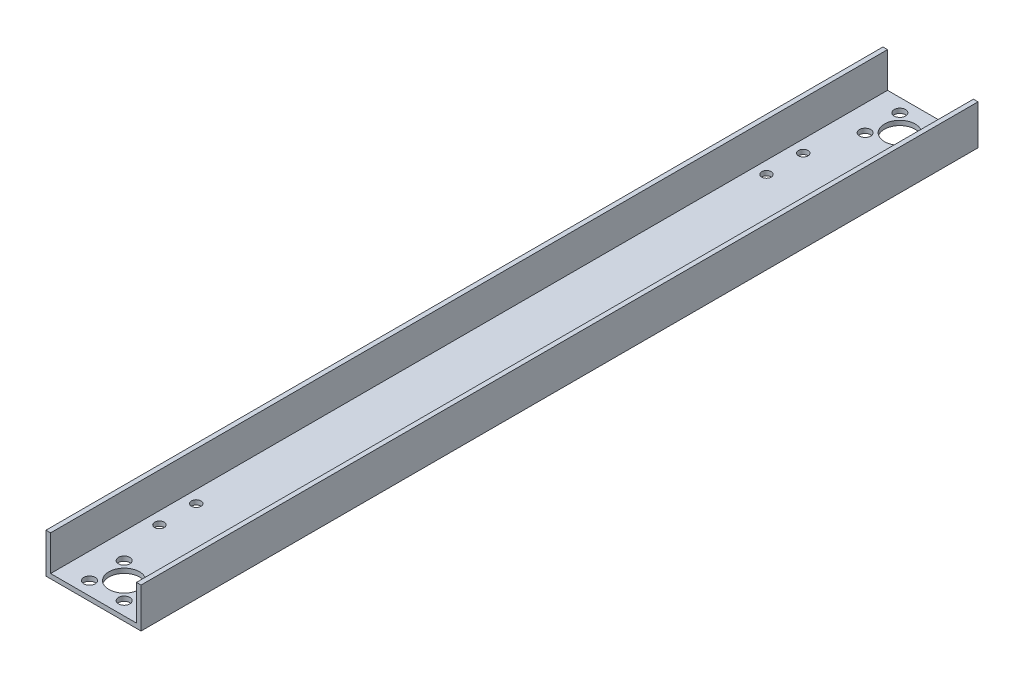
from build123d import *

# Parameters (mm, degrees)
BOSS_EXTRUDE1_DEPTH = 273
SKETCH3_R           = 1.85
SKETCH3_R_2         = 5
CUT_EXTRUDE1_DEPTH  = 273
SKETCH5_R           = 1.55
CUT_EXTRUDE2_DEPTH  = 220


with BuildPart() as part:
    # Sketch1 → Boss-Extrude1 (new body)
    with BuildSketch(Plane.XY):
        Polygon((14, 6.5), (15.5, 6.5), (15.5, -6.5), (-15.5, -6.5), (-15.5, 6.5), (-14, 6.5), (-14, -5), (14, -5), align=None)
    extrude(amount=BOSS_EXTRUDE1_DEPTH)

    # Sketch3 → Cut-Extrude1 (cut)
    with BuildSketch(Plane(origin=(0, -5, 0), x_dir=(1, 0, 0), z_dir=(0, 1, 0))):
        with Locations(Location((-5.656854249, -4.343145751, 0), (0, 0, 270))):
            Circle(SKETCH3_R)
        with Locations(Location((0, -263, 0), (0, 0, 270))):
            Circle(SKETCH3_R_2)
        with Locations(Location((-5.656854249, -257.343145751, 0), (0, 0, 270))):
            Circle(SKETCH3_R)
        with Locations(Location((5.656854249, -257.343145751, 0), (0, 0, 270))):
            Circle(SKETCH3_R)
        with Locations(Location((5.656854249, -268.656854249, 0), (0, 0, 270))):
            Circle(SKETCH3_R)
        with Locations(Location((-5.656854249, -268.656854249, 0), (0, 0, 270))):
            Circle(SKETCH3_R)
        with Locations(Location((5.656854249, -4.343145751, 0), (0, 0, 270))):
            Circle(SKETCH3_R)
        with Locations(Location((5.656854249, -15.656854249, 0), (0, 0, 270))):
            Circle(SKETCH3_R)
        with Locations(Location((-5.656854249, -15.656854249, 0), (0, 0, 270))):
            Circle(SKETCH3_R)
        with Locations(Location((0, -10, 0), (0, 0, 270))):
            Circle(SKETCH3_R_2)
    extrude(amount=-CUT_EXTRUDE1_DEPTH, mode=Mode.SUBTRACT)

    # Sketch5 → Cut-Extrude2 (cut)
    with BuildSketch(Plane.XZ.offset(6.5)):
        with Locations(Location((-10, 229.5, 0), (0, 0, 270))):
            Circle(SKETCH5_R)
        with Locations(Location((-10, 241.5, 0), (0, 0, 270))):
            Circle(SKETCH5_R)
        with Locations(Location((10, 229.5, 0), (0, 0, 270))):
            Circle(SKETCH5_R)
        with Locations(Location((10, 241.5, 0), (0, 0, 270))):
            Circle(SKETCH5_R)
        with Locations(Location((10, 31.5, 0), (0, 0, 270))):
            Circle(SKETCH5_R)
        with Locations(Location((10, 43.5, 0), (0, 0, 270))):
            Circle(SKETCH5_R)
        with Locations(Location((-10, 31.5, 0), (0, 0, 270))):
            Circle(SKETCH5_R)
        with Locations(Location((-10, 43.5, 0), (0, 0, 270))):
            Circle(SKETCH5_R)
    extrude(amount=-CUT_EXTRUDE2_DEPTH, mode=Mode.SUBTRACT)


solid = part.part
